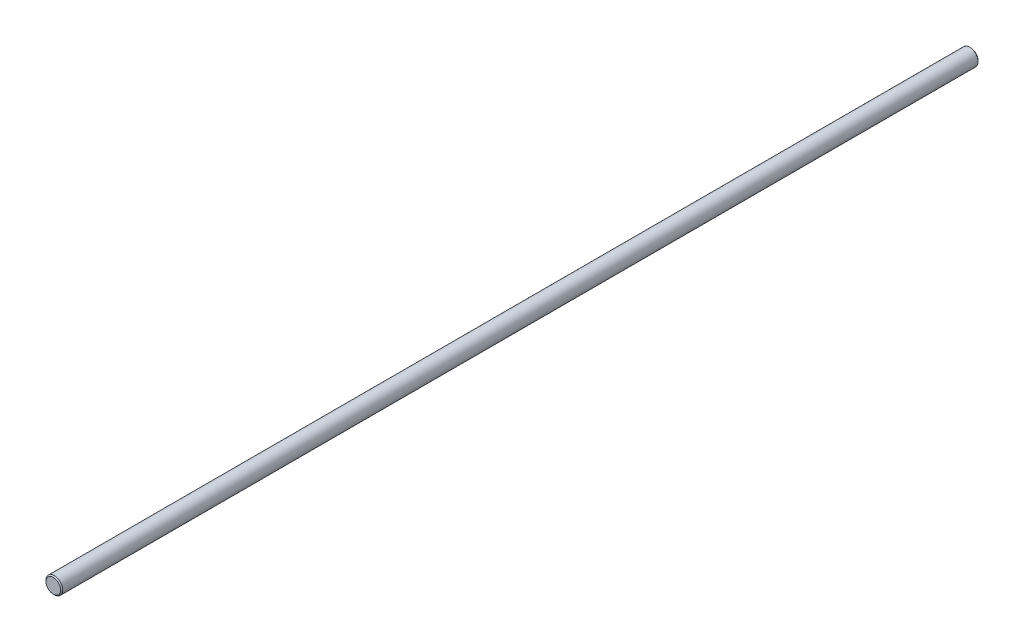
from build123d import *


with BuildPart() as part:
    # Sketch1 → Revolve1 (revolve)
    with BuildSketch(Plane.XZ, mode=Mode.PRIVATE) as revolve1_sk:
        Polygon((3.5, 440), (0, 440), (0, 0), (3.5, 0), (4, 0.5), (4, 439.5), align=None)
    revolve(revolve1_sk.sketch.rotate(Axis((0, 0, 440), (0, 0, -1)), 180), axis=Axis((0, 0, 440), (0, 0, -1)))


solid = part.part
